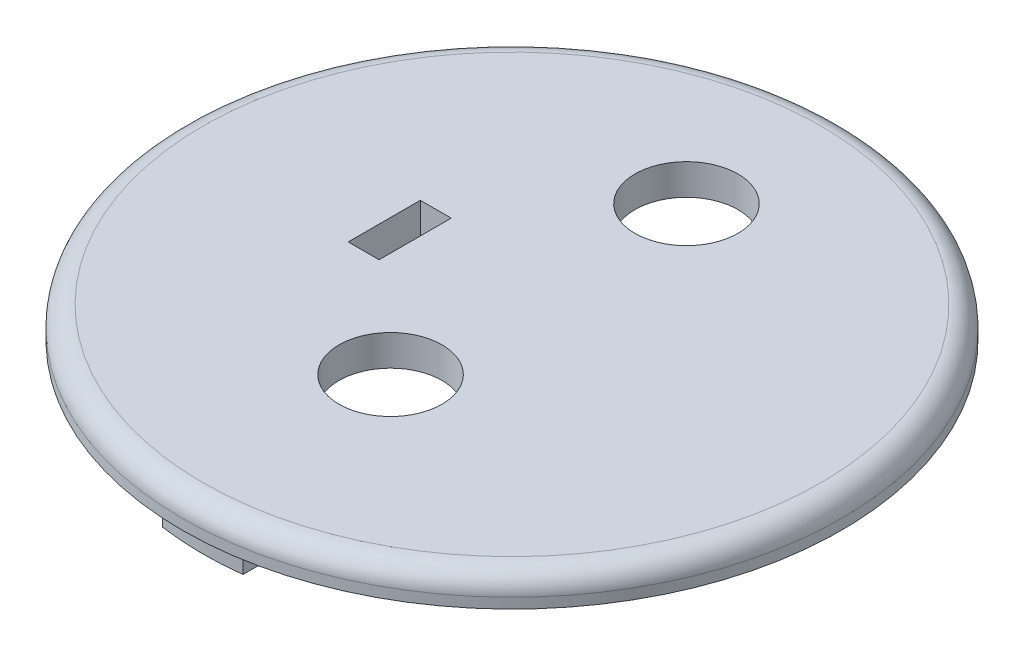
from build123d import *

# Parameters (mm, degrees)
ESQUISSE2_R             = 32
ESQUISSE2_R_2           = 5
BOSS_EXTRU_1_DEPTH      = 3
CONG_1_R                = 2
BOSS_EXTRU_2_DEPTH      = 3
ESQUISSE4_W             = 3
ESQUISSE4_H             = 7
ENL_V_MAT_EXTRU_1_DEPTH = 10


with BuildPart() as part:
    # Esquisse2 → Boss.-Extru.1 (new body)
    with BuildSketch(Plane(origin=(0, 0, 0), x_dir=(1, 0, 0), z_dir=(0, 1, 0))):
        with Locations(Location((0, 0, 0), (0, 0, 270))):
            Circle(ESQUISSE2_R)
        with Locations(Location((0, -11.795669906, 0), (0, 0, 270))):
            Circle(ESQUISSE2_R_2, mode=Mode.SUBTRACT)
        with Locations(Location((0, 16.939646256, 0), (0, 0, 270))):
            Circle(ESQUISSE2_R_2, mode=Mode.SUBTRACT)
    extrude(amount=BOSS_EXTRU_1_DEPTH)

    # Congé1
    cong_1_edges = [part.edges().sort_by_distance(p)[0] for p in [
        (0, 3, -32),
    ]]
    fillet(cong_1_edges, radius=CONG_1_R)

    # Esquisse3 → Boss.-Extru.2 (add)
    with BuildSketch(Plane.XZ):
        with BuildLine():
            Line((-4.252814477, 29.697029633), (-4.252814477, 28.09287077))
            Line((-4.252814477, 28.09287077), (3.65484317, 28.09287077))
            Line((3.65484317, 28.09287077), (3.65484317, 29.776536424))
            add(Edge.make_bspline(
                [(-4.252814477, 29.697029633), (-0.301616898, 30.260197697), (3.65484317, 29.776536424)],
                knots=[0, 0, 0, 1, 1, 1], degree=2))
        make_face()
        with BuildLine():
            Line((-4.252814477, -28.09287077), (3.65484317, -28.09287077))
            Line((3.65484317, -28.09287077), (3.65484317, -29.776536424))
            add(Edge.make_bspline(
                [(-4.252814477, -29.697029633), (-0.301616898, -30.260197697), (3.65484317, -29.776536424)],
                knots=[0, 0, 0, 1, 1, 1], degree=2))
            Line((-4.252814477, -29.697029633), (-4.252814477, -28.09287077))
        make_face()
    extrude(amount=BOSS_EXTRU_2_DEPTH)

    # Esquisse4 → Enlèv. mat.-Extru.1 (cut)
    with BuildSketch(Plane(origin=(0, 3, 0), x_dir=(1, 0, 0), z_dir=(0, 1, 0))):
        with Locations((-11.703666828, 0.799999388)):
            Rectangle(ESQUISSE4_W, ESQUISSE4_H)
    extrude(amount=-ENL_V_MAT_EXTRU_1_DEPTH, mode=Mode.SUBTRACT)


solid = part.part
